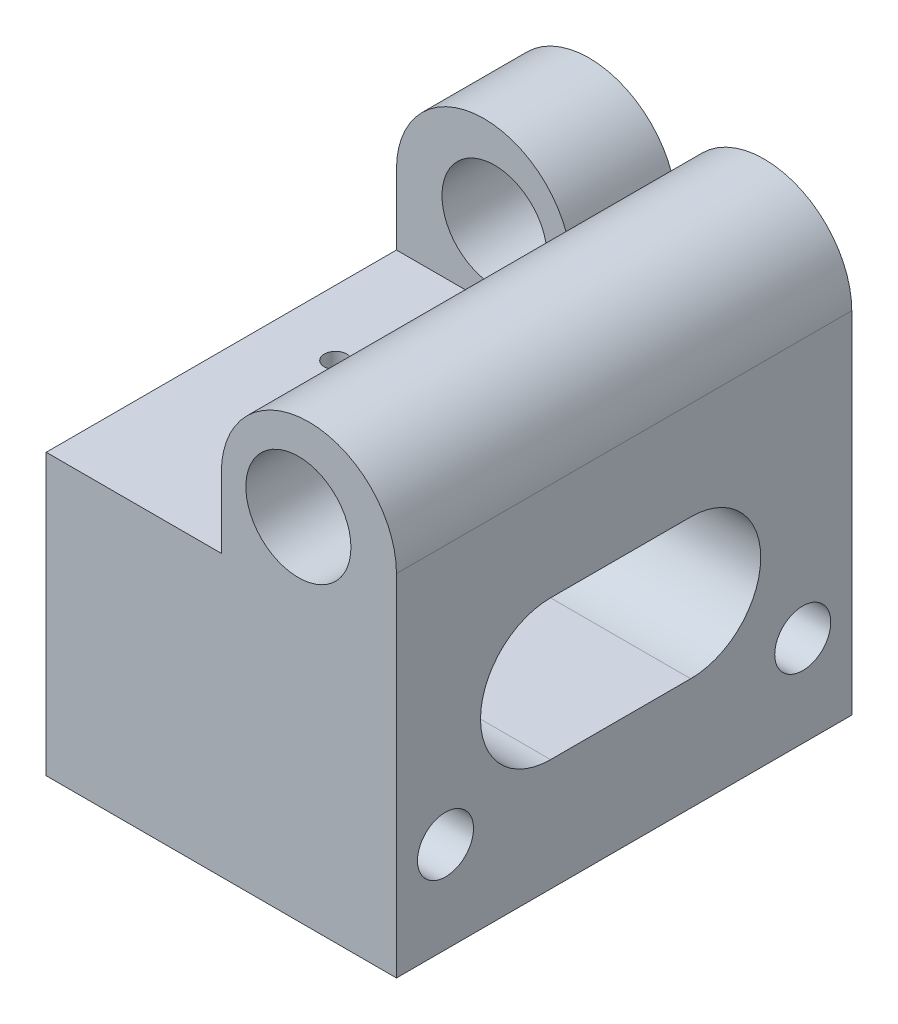
from build123d import *

# Parameters (mm, degrees)
SKETCH1_R               = 7.5
BOSS_EXTRUDE1_DEPTH     = 15
SKETCH2_R               = 7.5
BOSS_EXTRUDE2_DEPTH     = 50
SKETCH3_W               = 50
SKETCH3_H               = 40
BOSS_EXTRUDE3_DEPTH     = 65
CUT_EXTRUDE1_DEPTH      = 105.024035684
CUT_EXTRUDE2_DEPTH      = 96.372952141
SKETCH9_R               = 4
CUT_EXTRUDE3_DEPTH      = 104.107953137
CUT_EXTRUDE4_DEPTH      = 95.272212237
CUT_EXTRUDE4_DEPTH_BACK = 95.272212237
SKETCH10_R              = 1.6


with BuildPart() as part:
    # Sketch1 → Boss-Extrude1 (new body)
    with BuildSketch(Plane.XY):
        with BuildLine():
            Line((0, 0), (50, 0))
            Line((50, 0), (50, 50))
            ThreePointArc((50, 50), (40.582575695, 63.228756555), (25, 58.660254038))
            ThreePointArc((25, 58.660254038), (9.417424305, 63.228756555), (0, 50))
            Line((0, 50), (0, 0))
        make_face()
        with Locations((36, 50)):
            Circle(SKETCH1_R, mode=Mode.SUBTRACT)
        with Locations((14, 50)):
            Circle(SKETCH1_R, mode=Mode.SUBTRACT)
    extrude(amount=BOSS_EXTRUDE1_DEPTH)

    # Sketch2 → Boss-Extrude2 (add)
    with BuildSketch(Plane.XY.offset(15)):
        with BuildLine():
            Line((25, 50), (25, 0))
            Line((25, 0), (50, 0))
            Line((50, 0), (50, 50))
            ThreePointArc((50, 50), (37.5, 62.5), (25, 50))
        make_face()
        with Locations((36, 50)):
            Circle(SKETCH2_R, mode=Mode.SUBTRACT)
    extrude(amount=BOSS_EXTRUDE2_DEPTH)

    # Sketch3 → Boss-Extrude3 (add)
    with BuildSketch(Plane(origin=(0, 0, 0), x_dir=(-1, 0, 0), z_dir=(0, 0, -1))):
        with Locations((-25, 20)):
            Rectangle(SKETCH3_W, SKETCH3_H)
    extrude(amount=-BOSS_EXTRUDE3_DEPTH)

    # Sketch4 → Cut-Extrude1 (cut, through all)
    with BuildSketch(Plane.ZY):
        with BuildLine():
            Line((23, 36), (43, 36))
            ThreePointArc((43, 36), (53, 26), (43, 16))
            Line((43, 16), (23, 16))
            ThreePointArc((23, 16), (13, 26), (23, 36))
        make_face()
    extrude(amount=-CUT_EXTRUDE1_DEPTH, mode=Mode.SUBTRACT)

    # Sketch2<3> → Cut-Extrude2 (cut, through all)
    with BuildSketch(Plane.XY.offset(15)):
        with BuildLine():
            ThreePointArc((25, 58.660254038), (9.417424305, 63.228756555), (0, 50))
            ThreePointArc((0, 50), (12.5, 62.5), (25, 50))
            ThreePointArc((25, 50), (37.5, 62.5), (50, 50))
            ThreePointArc((50, 50), (40.582575695, 63.228756555), (25, 58.660254038))
        make_face()
    extrude(amount=-CUT_EXTRUDE2_DEPTH, mode=Mode.SUBTRACT)

    # Sketch9 → Cut-Extrude3 (cut, through all)
    with BuildSketch(Plane.ZY):
        with Locations((7, 13)):
            Circle(SKETCH9_R)
        with Locations((58, 13)):
            Circle(SKETCH9_R)
    extrude(amount=-CUT_EXTRUDE3_DEPTH, mode=Mode.SUBTRACT)

    # Sketch10 → Cut-Extrude4 (cut, two sides: drawn at the far end of the back side and taken through both)
    with BuildSketch(Plane(origin=(0, 16, 0), x_dir=(1, 0, 0), z_dir=(0, 1, 0)).offset(-CUT_EXTRUDE4_DEPTH_BACK)):
        with Locations((9.306144925, -33)):
            Circle(SKETCH10_R)
    extrude(amount=CUT_EXTRUDE4_DEPTH + CUT_EXTRUDE4_DEPTH_BACK, mode=Mode.SUBTRACT)


solid = part.part
